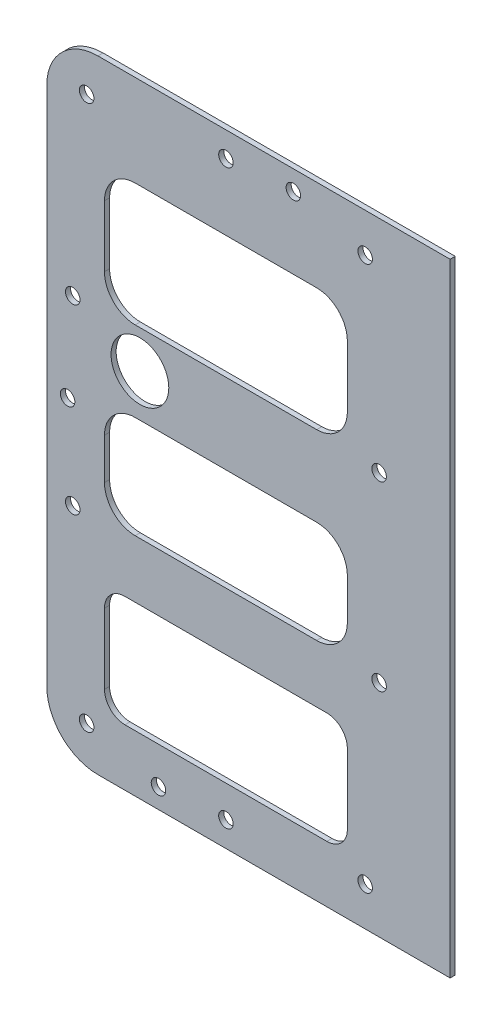
from build123d import *

# Parameters (mm, degrees)
SKETCH2_W            = 111.125
SKETCH2_H            = 193.04
BOSS_EXTRUDE1_DEPTH  = 1.5875
M4_CLEARANCE_HOLE1_D = 4.5
FILLET1_R            = 15.875
SKETCH6_R            = 2.4003
SKETCH6_R_2          = 3
SKETCH6_R_3          = 6.477
SKETCH6_R_4          = 10.762
CUT_EXTRUDE1_DEPTH   = 212.192646736
SKETCH7_W            = 13.97
SKETCH7_H            = 193.04
BOSS_EXTRUDE2_DEPTH  = 1.5875
SKETCH8_W            = 75.32443897
SKETCH8_H            = 38.1
SKETCH8_R            = 10.762
SKETCH8_R_2          = 3
SKETCH8_H_2          = 31.75
SKETCH8_H_3          = 34.487219484
SKETCH8_R_3          = 2.4003
SKETCH8_R_4          = 6.477
SKETCH8_R_5          = 8.9535
CUT_EXTRUDE2_DEPTH   = 1.5875
FILLET2_R            = 9.525
FILLET3_R            = 6.35
FILLET4_R            = 9.525


with BuildPart() as part:
    # Sketch2 → Boss-Extrude1 (new body)
    with BuildSketch(Plane.XY.offset(-401.504104662)):
        with Locations((-6.650833159, 105.295051609)):
            Rectangle(SKETCH2_W, SKETCH2_H)
    extrude(amount=BOSS_EXTRUDE1_DEPTH)

    # M4 Clearance Hole1 (through all)
    with Locations(Plane.XY.offset(-399.916604662)):
        with Locations((36.540537091, 189.761421859), (-6.650833159, 194.079751609), (-49.842203409, 189.761421859), (-54.160533159, 133.489051609), (-54.160533159, 77.101051609), (-49.842203409, 20.82868136), (-6.650833159, 16.510351609), (36.540537091, 20.82868136), (40.858866841, 77.101051609), (40.858866841, 133.489051609), (14.260079544, 195.670051609), (-55.750833159, 105.295051609), (-27.561745863, 14.920051609)):
            Hole(M4_CLEARANCE_HOLE1_D / 2)

    # Fillet1
    fillet1_edges = [part.edges().sort_by_distance(p)[0] for p in [
        (-62.213333159, 201.815051609, -400.710354662),
        (-62.213333159, 8.775051609, -400.710354662),
    ]]
    fillet(fillet1_edges, radius=FILLET1_R)

    # Sketch6 → Cut-Extrude1 (cut, through all)
    with BuildSketch(Plane.XY.offset(-399.916604662)):
        with Locations((-34.590833159, 43.382551609)):
            Circle(SKETCH6_R)
        with Locations((21.289166841, 43.382551609)):
            Circle(SKETCH6_R)
        with Locations((-20.884724927, 142.590766631)):
            Circle(SKETCH6_R_2)
        with Locations((7.583058609, 166.225175879)):
            Circle(SKETCH6_R_2)
        with Locations((3.509166841, 43.382551609)):
            Circle(SKETCH6_R_3)
        with Locations((-16.810833159, 43.382551609)):
            Circle(SKETCH6_R_3)
        with Locations((-33.320833159, 123.670051609)):
            Circle(SKETCH6_R_3)
        with Locations((-6.650833159, 154.407971255)):
            Circle(SKETCH6_R_4)
        with Locations((-6.650833159, 94.607131964)):
            Circle(SKETCH6_R_4)
    extrude(amount=-CUT_EXTRUDE1_DEPTH, mode=Mode.SUBTRACT)

    # Sketch7 → Boss-Extrude2 (add)
    with BuildSketch(Plane.XY.offset(-399.916604662)):
        with Locations((55.896666841, 105.295051609)):
            Rectangle(SKETCH7_W, SKETCH7_H)
    extrude(amount=-BOSS_EXTRUDE2_DEPTH)

    # Sketch8 → Cut-Extrude2 (cut)
    # profile 1 of 4: a face of its own
    with BuildSketch(Plane.XY.offset(-399.916604662)):
        with Locations((-6.650833159, 154.407971255)):
            Rectangle(SKETCH8_W, SKETCH8_H)
        with Locations((-6.650833159, 154.407971255)):
            Circle(SKETCH8_R, mode=Mode.SUBTRACT)
        with Locations((7.583058609, 166.225175879)):
            Circle(SKETCH8_R_2, mode=Mode.SUBTRACT)
        with Locations((-20.884724927, 142.590766631)):
            Circle(SKETCH8_R_2, mode=Mode.SUBTRACT)
    # profile 2 of 4: a face of its own
    with BuildSketch(Plane.XY.offset(-399.916604662)):
        with Locations((-6.650833159, 94.607131964)):
            Rectangle(SKETCH8_W, SKETCH8_H_2)
        with Locations((-6.650833159, 94.607131964)):
            Circle(SKETCH8_R, mode=Mode.SUBTRACT)
    # profile 3 of 4: a face of its own
    with BuildSketch(Plane.XY.offset(-399.916604662)):
        with Locations((-6.650833159, 43.601441867)):
            Rectangle(SKETCH8_W, SKETCH8_H_3)
        with Locations((-34.590833159, 43.382551609)):
            Circle(SKETCH8_R_3, mode=Mode.SUBTRACT)
        with Locations((-16.810833159, 43.382551609)):
            Circle(SKETCH8_R_4, mode=Mode.SUBTRACT)
        with Locations((3.509166841, 43.382551609)):
            Circle(SKETCH8_R_4, mode=Mode.SUBTRACT)
        with Locations((21.289166841, 43.382551609)):
            Circle(SKETCH8_R_3, mode=Mode.SUBTRACT)
    # profile 4 of 4: a face of its own
    with BuildSketch(Plane.XY.offset(-399.916604662)):
        with Locations((-33.320833159, 123.670051609)):
            Circle(SKETCH8_R_5)
        with Locations((-33.320833159, 123.670051609)):
            Circle(SKETCH8_R_4, mode=Mode.SUBTRACT)
    extrude(amount=-CUT_EXTRUDE2_DEPTH, mode=Mode.SUBTRACT)

    # Fillet2
    fillet2_edges = [part.edges().sort_by_distance(p)[0] for p in [
        (-44.313052644, 173.457971255, -400.710354662),
        (-44.313052644, 135.357971255, -400.710354662),
        (31.011386326, 135.357971255, -400.710354662),
        (31.011386326, 173.457971255, -400.710354662),
    ]]
    fillet(fillet2_edges, radius=FILLET2_R)

    # Fillet3
    fillet3_edges = [part.edges().sort_by_distance(p)[0] for p in [
        (-44.313052644, 26.357832125, -400.710354662),
        (31.011386326, 26.357832125, -400.710354662),
        (31.011386326, 60.845051609, -400.710354662),
        (-44.313052644, 60.845051609, -400.710354662),
    ]]
    fillet(fillet3_edges, radius=FILLET3_R)

    # Fillet4
    fillet4_edges = [part.edges().sort_by_distance(p)[0] for p in [
        (-44.313052644, 110.482131964, -400.710354662),
        (-44.313052644, 78.732131964, -400.710354662),
        (31.011386326, 78.732131964, -400.710354662),
        (31.011386326, 110.482131964, -400.710354662),
    ]]
    fillet(fillet4_edges, radius=FILLET4_R)


solid = part.part
